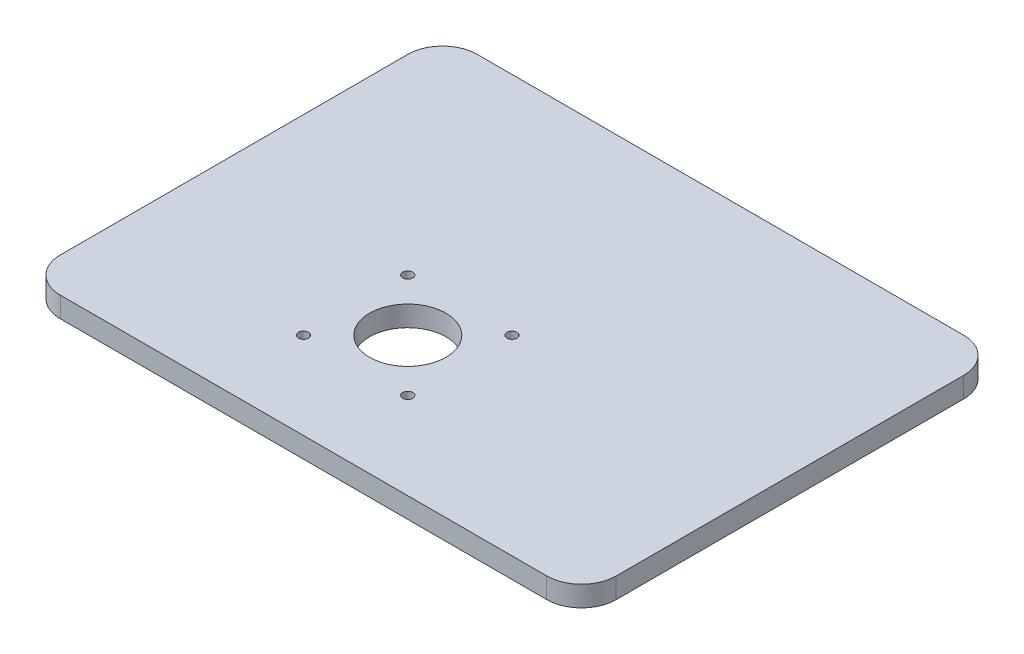
from build123d import *

# Parameters (mm, degrees)
SKETCH3_W           = 160
SKETCH3_H           = 120
SKETCH3_R           = 11
SKETCH3_R_2         = 1.45
BOSS_EXTRUDE1_DEPTH = 5.9
FILLET1_R           = 10


with BuildPart() as part:
    # Sketch3 → Boss-Extrude1 (new body)
    with BuildSketch(Plane(origin=(0, 0, 0), x_dir=(1, 0, 0), z_dir=(0, 1, 0))):
        with Locations((80, -56.67036626)):
            Rectangle(SKETCH3_W, SKETCH3_H)
        with Locations(Location((70, -76.67036626, 0), (0, 0, 270))):
            Circle(SKETCH3_R, mode=Mode.SUBTRACT)
        with Locations(Location((55, -61.67036626, 0), (0, 0, 270))):
            Circle(SKETCH3_R_2, mode=Mode.SUBTRACT)
        with Locations(Location((85, -61.67036626, 0), (0, 0, 270))):
            Circle(SKETCH3_R_2, mode=Mode.SUBTRACT)
        with Locations(Location((85, -91.67036626, 0), (0, 0, 270))):
            Circle(SKETCH3_R_2, mode=Mode.SUBTRACT)
        with Locations(Location((55, -91.67036626, 0), (0, 0, 270))):
            Circle(SKETCH3_R_2, mode=Mode.SUBTRACT)
    extrude(amount=BOSS_EXTRUDE1_DEPTH)

    # Fillet1
    fillet1_edges = [part.edges().sort_by_distance(p)[0] for p in [
        (0, 2.95, -3.32963374),
        (160, 2.95, -3.32963374),
        (160, 2.95, 116.67036626),
        (0, 2.95, 116.67036626),
    ]]
    fillet(fillet1_edges, radius=FILLET1_R)


solid = part.part
